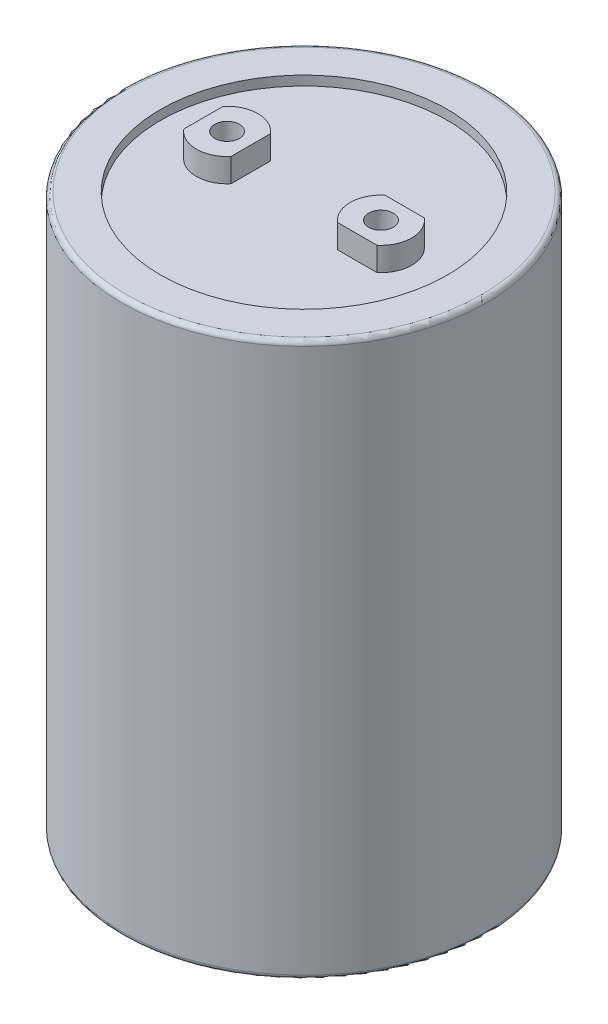
from build123d import *

# Parameters (mm, degrees)
SKETCH1_R           = 38.5
BOSS_EXTRUDE1_DEPTH = 115
SKETCH2_R           = 2.6
BOSS_EXTRUDE2_DEPTH = 5
SKETCH3_R           = 38.5
SKETCH3_R_2         = 30.3
BOSS_EXTRUDE3_DEPTH = 2
FILLET1_R           = 1
ESQUISSE1_R         = 6
BOSS_EXTRU_1_DEPTH  = 16


with BuildPart() as part:
    # Sketch1 → Boss-Extrude1 (new body)
    with BuildSketch(Plane(origin=(0, 0, 0), x_dir=(1, 0, 0), z_dir=(0, 1, 0))):
        with Locations(Location((0, 0, 0), (0, 0, 270))):
            Circle(SKETCH1_R)
    extrude(amount=BOSS_EXTRUDE1_DEPTH)

    # Sketch2 → Boss-Extrude2 (add)
    # profile 1 of 2: a face of its own
    with BuildSketch(Plane(origin=(0, 115, 0), x_dir=(1, 0, 0), z_dir=(0, 1, 0))):
        with BuildLine():
            Line((-21.25, 4.153311931), (-21.25, -4.153311931))
            ThreePointArc((-21.25, -4.153311931), (-16.25, -6.5), (-11.25, -4.153311931))
            Line((-11.25, -4.153311931), (-11.25, 4.153311931))
            ThreePointArc((-11.25, 4.153311931), (-16.25, 6.5), (-21.25, 4.153311931))
        make_face()
        with Locations(Location((-16.25, 0, 0), (0, 0, 270))):
            Circle(SKETCH2_R, mode=Mode.SUBTRACT)
    # profile 2 of 2: a face of its own
    with BuildSketch(Plane(origin=(0, 115, 0), x_dir=(1, 0, 0), z_dir=(0, 1, 0))):
        with BuildLine():
            Line((12.096688069, 5), (20.403311931, 5))
            ThreePointArc((20.403311931, 5), (22.75, 0), (20.403311931, -5))
            Line((20.403311931, -5), (12.096688069, -5))
            ThreePointArc((12.096688069, -5), (9.75, 0), (12.096688069, 5))
        make_face()
        with Locations(Location((16.25, 0, 0), (0, 0, 270))):
            Circle(SKETCH2_R, mode=Mode.SUBTRACT)
    extrude(amount=BOSS_EXTRUDE2_DEPTH)

    # Sketch3 → Boss-Extrude3 (add)
    with BuildSketch(Plane(origin=(0, 115, 0), x_dir=(1, 0, 0), z_dir=(0, 1, 0))):
        with Locations(Location((0, 0, 0), (0, 0, 270))):
            Circle(SKETCH3_R)
        with Locations(Location((0, 0, 0), (0, 0, 270))):
            Circle(SKETCH3_R_2, mode=Mode.SUBTRACT)
    extrude(amount=BOSS_EXTRUDE3_DEPTH)

    # Fillet1
    fillet1_edges = [part.edges().sort_by_distance(p)[0] for p in [
        (0, 0, -38.5),
        (0, 117, -38.5),
    ]]
    fillet(fillet1_edges, radius=FILLET1_R)

    # Esquisse1 → Boss.-Extru.1 (add)
    with BuildSketch(Plane.XZ):
        with Locations(Location((0, 0, 0), (0, 0, 90))):
            Circle(ESQUISSE1_R)
    extrude(amount=BOSS_EXTRU_1_DEPTH)


solid = part.part
